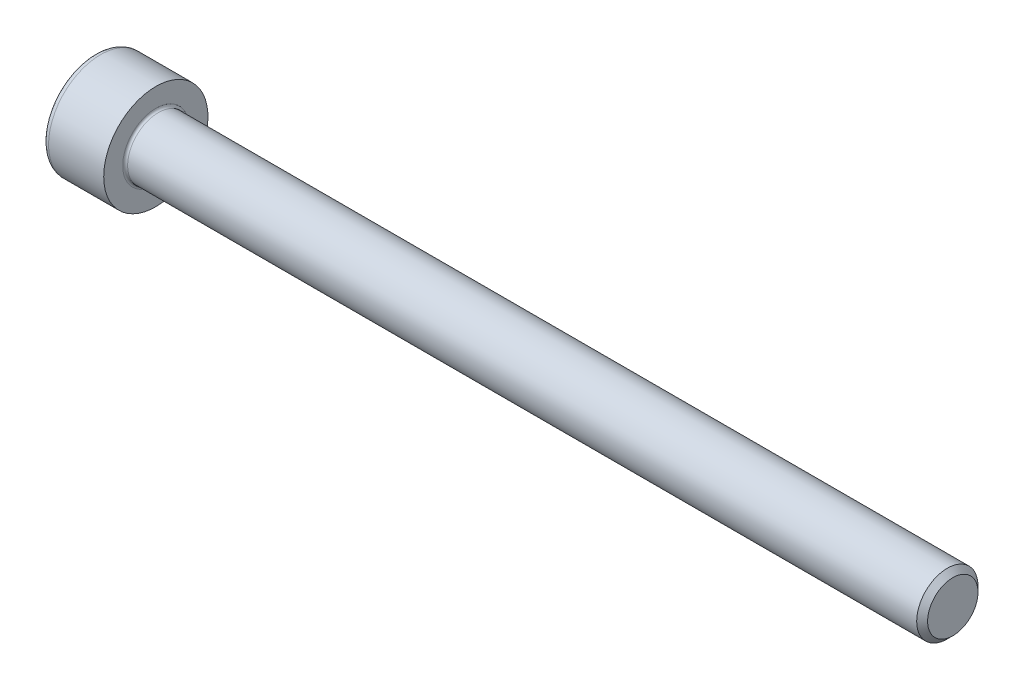
from build123d import *

# Parameters (mm, degrees)
FILLET1_R   = 0.2
FILLET2_R   = 0.5
HEX_2_DEPTH = 2.5


with BuildPart() as part:
    # BodySke → Base-Revolve (revolve)
    with BuildSketch(Plane.XY, mode=Mode.PRIVATE) as base_revolve_sk:
        Polygon((0, 0), (0, 4.25), (5, 4.25), (5, 2.5), (69.555, 2.5), (70, 2.055), (70, 0), align=None)
    revolve(base_revolve_sk.sketch.rotate(Axis((-31.75, 0, 0), (1, 0, 0)), 90), axis=Axis((-31.75, 0, 0), (1, 0, 0)))

    # Fillet1
    fillet1_edges = [part.edges().sort_by_distance(p)[0] for p in [
        (5, 0, -2.5),
    ]]
    fillet(fillet1_edges, radius=FILLET1_R)

    # Fillet2
    fillet2_edges = [part.edges().sort_by_distance(p)[0] for p in [
        (0, 0, -4.25),
    ]]
    fillet(fillet2_edges, radius=FILLET2_R)

    # Sketch2 → Hex-PreBroach (revolve, cut)
    with BuildSketch(Plane.XY, mode=Mode.PRIVATE) as hex_prebroach_sk:
        Polygon((0, 2.01), (2.5, 2.01), (3.660474041, 0), (0, 0), align=None)
    revolve(hex_prebroach_sk.sketch.rotate(Axis((0, 0, 0), (1, 0, 0)), 90), axis=Axis((0, 0, 0), (1, 0, 0)), mode=Mode.SUBTRACT)

    # Sketch3 → Hex 2 (cut)
    with BuildSketch(Plane(origin=(0, 0, 0), x_dir=(0, 0.500000000000001, 0.866025403784438), z_dir=(-1, 0, 0))):
        Polygon((1.160474041, 2.01), (-1.160474041, 2.01), (-2.320948082, 0), (-1.160474041, -2.01), (1.160474041, -2.01), (2.320948082, 0), align=None)
    extrude(amount=-HEX_2_DEPTH, mode=Mode.SUBTRACT)


solid = part.part
